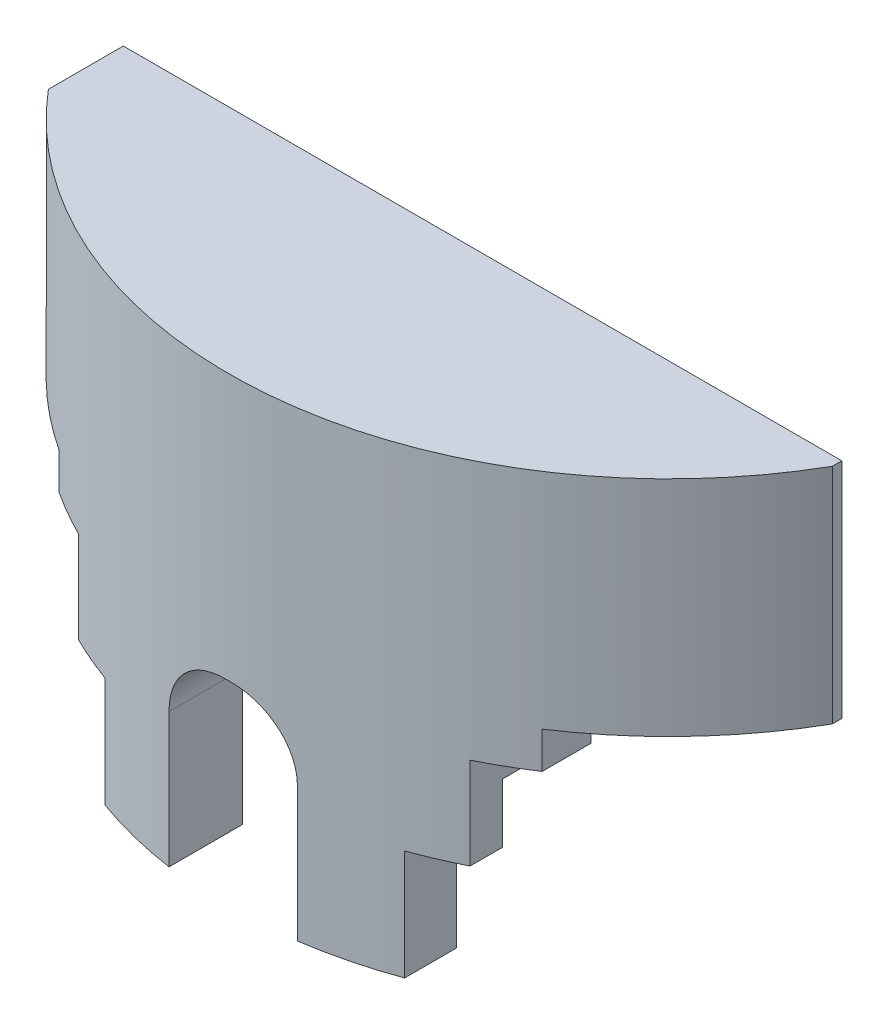
from build123d import *

# Parameters (mm, degrees)
BOSS_EXTRUDE1_DEPTH = 36.5
BOSS_EXTRUDE2_DEPTH = 6
BOSS_EXTRUDE3_DEPTH = 15
BOSS_EXTRUDE4_DEPTH = 18
CUT_EXTRUDE2_DEPTH  = 25
SKETCH5_W           = 21
SKETCH5_H           = 37.8
CUT_EXTRUDE1_DEPTH  = 32
FILLET1_R           = 10
CUT_EXTRUDE3_DEPTH  = 18
SKETCH9_W           = 81.549954628
SKETCH9_H           = 20
CUT_EXTRUDE4_DEPTH  = 18
SKETCH10_W          = 7.5
SKETCH10_H          = 36.5
CUT_EXTRUDE6_DEPTH  = 106.049226723


with BuildPart() as part:
    # Sketch1 → Boss-Extrude1 (new body)
    with BuildSketch(Plane(origin=(0, 0, 0), x_dir=(1, 0, 0), z_dir=(0, 1, 0))):
        with BuildLine():
            Line((-62.5, -34.2), (-62.5, -35.745629103))
            ThreePointArc((-62.5, -35.745629103), (0, -72), (62.5, -35.745629103))
            Line((62.5, -35.745629103), (62.5, -34.2))
            Line((62.5, -34.2), (-62.5, -34.2))
        make_face()
    extrude(amount=-BOSS_EXTRUDE1_DEPTH)

    # Sketch2 → Boss-Extrude2 (add)
    with BuildSketch(Plane.XZ.offset(36.5)):
        with BuildLine():
            ThreePointArc((39.5, 60.197591314), (0, 72), (-39.5, 60.197591314))
            Line((-39.5, 60.197591314), (-39.5, 34.2))
            Line((-39.5, 34.2), (39.5, 34.2))
            Line((39.5, 34.2), (39.5, 60.197591314))
        make_face()
    extrude(amount=BOSS_EXTRUDE2_DEPTH)

    # Sketch3 → Boss-Extrude3 (add)
    with BuildSketch(Plane.XZ.offset(42.5)):
        with BuildLine():
            Line((-32, 64.498061986), (-32, 34.2))
            Line((-32, 34.2), (32, 34.2))
            Line((32, 34.2), (32, 64.498061986))
            ThreePointArc((32, 64.498061986), (0, 72), (-32, 64.498061986))
        make_face()
    extrude(amount=BOSS_EXTRUDE3_DEPTH)

    # Sketch4 → Boss-Extrude4 (add)
    with BuildSketch(Plane.XZ.offset(57.5)):
        with BuildLine():
            Line((-24.5, 34.2), (-24.5, 67.703397256))
            ThreePointArc((-24.5, 67.703397256), (0, 72), (24.5, 67.703397256))
            Line((24.5, 67.703397256), (24.5, 34.2))
            Line((24.5, 34.2), (-24.5, 34.2))
        make_face()
    extrude(amount=BOSS_EXTRUDE4_DEPTH)

    # Sketch7 → Cut-Extrude2 (cut)
    with BuildSketch(Plane(origin=(0, 0, 34.2), x_dir=(-1, 0, 0), z_dir=(0, 0, -1))):
        with BuildLine():
            Line((-32.5, -53.5), (-32.5, -86))
            Line((-32.5, -86), (32.5, -86))
            Line((32.5, -86), (32.5, -53.5))
            ThreePointArc((32.5, -53.5), (0, -21), (-32.5, -53.5))
        make_face()
    extrude(amount=-CUT_EXTRUDE2_DEPTH, mode=Mode.SUBTRACT)

    # Sketch5 → Cut-Extrude1 (cut)
    with BuildSketch(Plane.XZ.offset(75.5)):
        with Locations((0, 53.1)):
            Rectangle(SKETCH5_W, SKETCH5_H)
    extrude(amount=-CUT_EXTRUDE1_DEPTH, mode=Mode.SUBTRACT)

    # Fillet1
    fillet1_edges = [part.edges().sort_by_distance(p)[0] for p in [
        (-10.5, -43.5, 65.215130212),
        (10.5, -43.5, 65.215130212),
    ]]
    fillet(fillet1_edges, radius=FILLET1_R)

    # Sketch8 → Cut-Extrude3 (cut)
    with BuildSketch(Plane(origin=(0, 0, 34.2), x_dir=(-1, 0, 0), z_dir=(0, 0, -1))):
        with BuildLine():
            Line((-27, -2), (27, -2))
            ThreePointArc((27, -2), (47, -22), (27, -42))
            Line((27, -42), (-27, -42))
            ThreePointArc((-27, -42), (-47, -22), (-27, -2))
        make_face()
    extrude(amount=-CUT_EXTRUDE3_DEPTH, mode=Mode.SUBTRACT)

    # Sketch9 → Cut-Extrude4 (cut)
    with BuildSketch(Plane(origin=(0, 0, 34.2), x_dir=(-1, 0, 0), z_dir=(0, 0, -1))):
        with Locations((0, -46.5)):
            Rectangle(SKETCH9_W, SKETCH9_H)
    extrude(amount=-CUT_EXTRUDE4_DEPTH, mode=Mode.SUBTRACT)

    # Sketch10 → Cut-Extrude6 (cut, through all)
    with BuildSketch(Plane(origin=(0, 0, 34.2), x_dir=(-1, 0, 0), z_dir=(0, 0, -1))):
        with Locations((58.75, -18.25)):
            Rectangle(SKETCH10_W, SKETCH10_H)
    extrude(amount=-CUT_EXTRUDE6_DEPTH, mode=Mode.SUBTRACT)


solid = part.part
